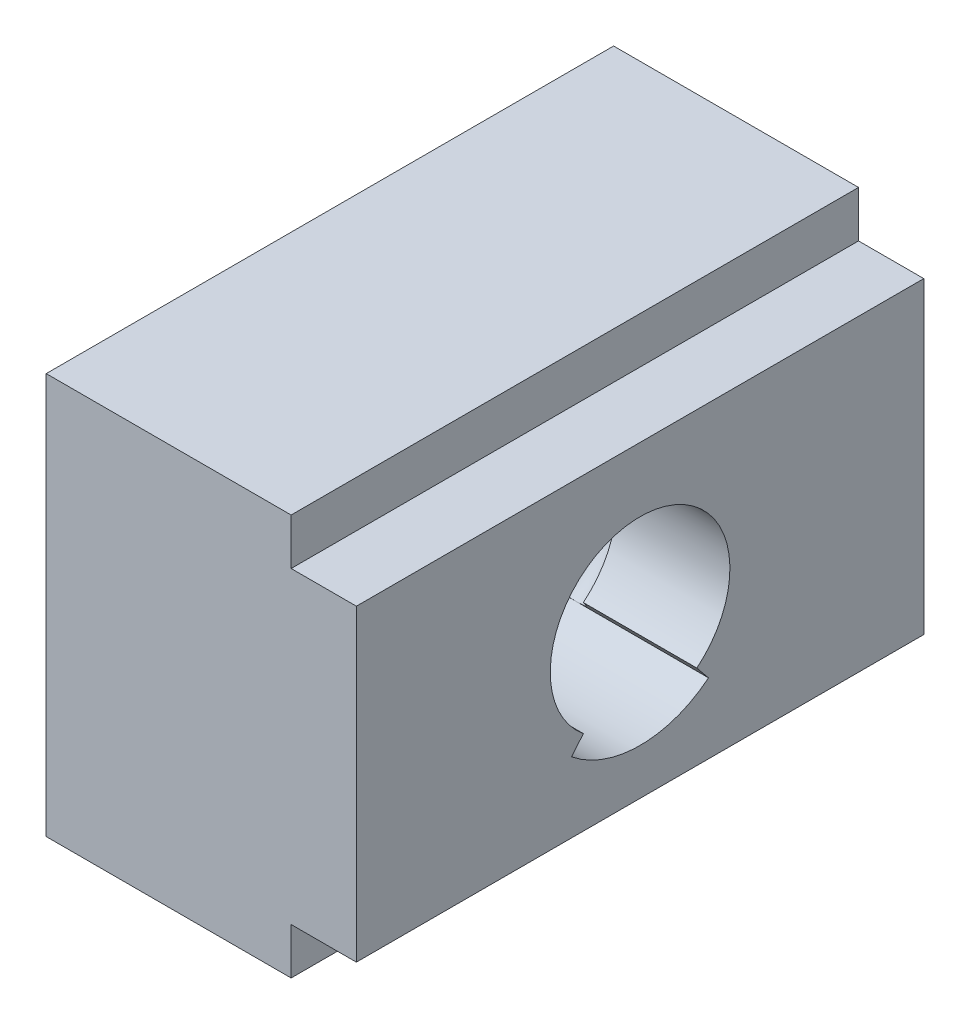
from build123d import *

# Parameters (mm, degrees)
BOSS_EXTRUDE1_DEPTH = 300
SKETCH2_R           = 47.5
CUT_EXTRUDE1_DEPTH  = 100
SKETCH3_R           = 10
CUT_EXTRUDE3_REACH  = 364.052


with BuildPart() as part:
    # Sketch1 → Boss-Extrude1 (new body)
    with BuildSketch(Plane.XY):
        Polygon((94.938651754, 94.603319173), (60.438651754, 94.603319173), (60.438651754, 119.103319173), (-69.061348246, 119.103319173), (-69.061348246, -92.896680827), (60.438651754, -92.896680827), (60.438651754, -68.396680827), (94.938651754, -68.396680827), align=None)
    extrude(amount=BOSS_EXTRUDE1_DEPTH)

    # Sketch2 → Cut-Extrude1 (cut)
    with BuildSketch(Plane(origin=(94.938651754, 0, 0), x_dir=(0, 0, -1), z_dir=(1, 0, 0))):
        with Locations((-150, 13.103319173)):
            Circle(SKETCH2_R)
    extrude(amount=-CUT_EXTRUDE1_DEPTH, mode=Mode.SUBTRACT)

    # Cut-Sweep1: sweep along a path in Sketch5
    with BuildLine(Plane(origin=(25, 0, 0), x_dir=(0, 0, -1), z_dir=(1, 0, 0))) as cut_sweep1_path:
        ThreePointArc((-120, -23.723980484), (-150, 60.603319173), (-180, -23.723980484))
    # Sketch3 → Cut-Sweep1 (sweep, cut)
    with BuildSketch(Plane.XY.offset(150)):
        with Locations((24.938651754, 60.373071265)):
            Circle(SKETCH3_R)
    sweep(path=cut_sweep1_path.line, mode=Mode.SUBTRACT)

    # Cut-Extrude3: up to this face of the body (flat: up to its plane)
    cut_extrude3_end = Plane(part.part.faces().sort_by_distance((-5.061348246, 13.103319173, 150))[0])
    # Sketch7 → Cut-Extrude3 (cut, up to the picked face)
    with BuildSketch(Plane(origin=(94.938651754, 0, 0), x_dir=(0, 0, -1), z_dir=(1, 0, 0)), mode=Mode.PRIVATE) as cut_extrude3_sk1:
        with BuildLine():
            Line((-180, -23.723980484), (-186.170369742, -31.298582333))
            ThreePointArc((-186.170369742, -31.298582333), (-150, -44.166432919), (-113.829630258, -31.298582333))
            Line((-113.829630258, -31.298582333), (-120, -23.723980484))
            ThreePointArc((-120, -23.723980484), (-150, -34.396680827), (-180, -23.723980484))
        make_face()
    cut_extrude3_tool1 = split(extrude(cut_extrude3_sk1.sketch, amount=-CUT_EXTRUDE3_REACH, mode=Mode.PRIVATE), bisect_by=cut_extrude3_end, keep=Keep.BOTH, mode=Mode.PRIVATE)
    add(cut_extrude3_tool1.solids().sort_by(Axis((94.938652, -35.436268, 150), (-1, 0, 0)))[0], mode=Mode.SUBTRACT)


solid = part.part
